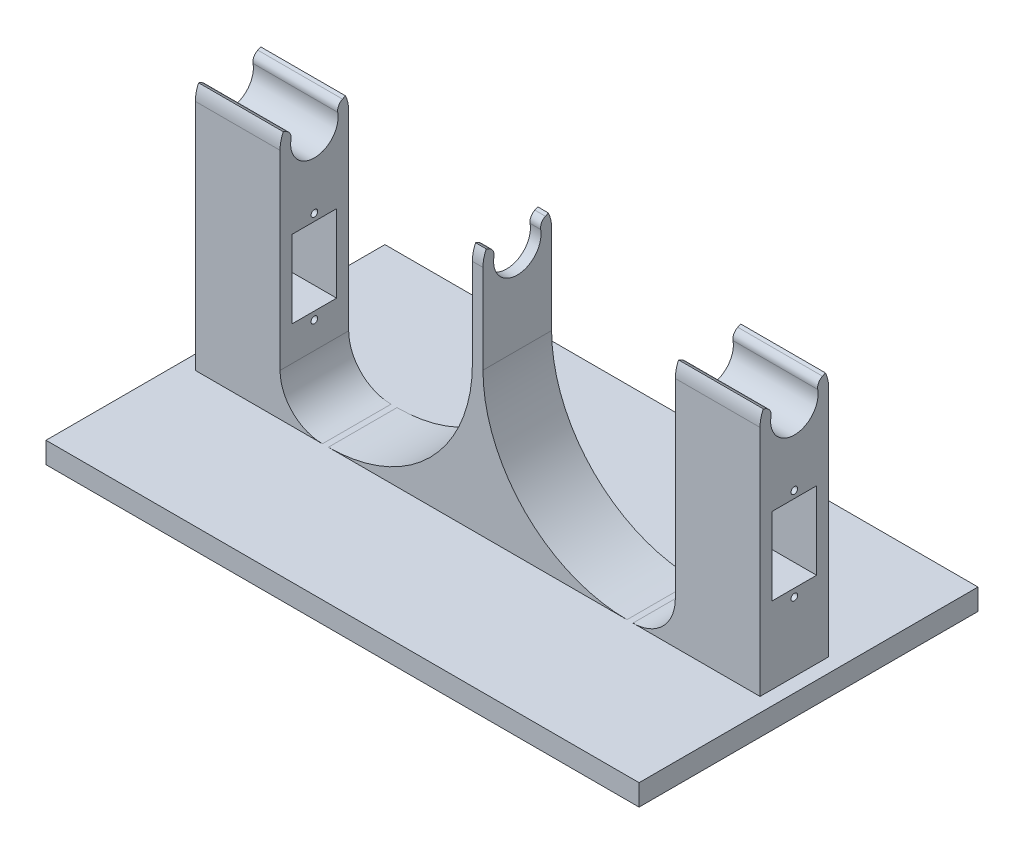
from build123d import *

# Parameters (mm, degrees)
SKETCH1_W           = 177.8
SKETCH1_H           = 101.6
BOSS_EXTRUDE1_DEPTH = 6.35
BOSS_EXTRUDE2_DEPTH = 177.8
SKETCH3_W           = 57.658
SKETCH3_H           = 101.6
SKETCH3_W_2         = 4.2545
CUT_EXTRUDE1_DEPTH  = 127.448072965
FILLET1_R           = 43.18
FILLET2_R           = 12.7
SKETCH5_R           = 1
SKETCH5_W           = 13.335
SKETCH5_H           = 23.241
CUT_EXTRUDE2_DEPTH  = 177.112534328
CUT_EXTRUDE3_START  = 118.491
SKETCH5_2_R         = 1
SKETCH5_2_W         = 13.335
SKETCH5_2_H         = 23.241
CUT_EXTRUDE3_DEPTH  = 58.621534328
FILLET4_R           = 2.54


with BuildPart() as part:
    # Sketch1 → Boss-Extrude1 (new body)
    with BuildSketch(Plane(origin=(0, 0, 0), x_dir=(1, 0, 0), z_dir=(0, 1, 0))):
        Rectangle(SKETCH1_W, SKETCH1_H)
    extrude(amount=BOSS_EXTRUDE1_DEPTH)

    # Sketch2 → Boss-Extrude2 (add)
    with BuildSketch(Plane.ZY.offset(88.9)):
        with BuildLine():
            Line((0, 69.088), (0, 6.35))
            Line((0, 6.35), (10.287, 6.35))
            Line((10.287, 6.35), (10.287, 76.2))
            ThreePointArc((10.287, 76.2), (10.043157025, 78.426514309), (9.323188205, 80.547474059))
            Line((9.323188205, 80.547474059), (6.445660981, 79.205661077))
            ThreePointArc((6.445660981, 79.205661077), (5.998199963, 72.378725185), (0, 69.088))
        make_face()
        with BuildLine():
            Line((-10.287, 76.2), (-10.287, 6.35))
            Line((-10.287, 6.35), (0, 6.35))
            Line((0, 6.35), (0, 69.088))
            ThreePointArc((0, 69.088), (-5.998199963, 72.378725185), (-6.445660981, 79.205661077))
            Line((-6.445660981, 79.205661077), (-9.323188205, 80.547474059))
            ThreePointArc((-9.323188205, 80.547474059), (-10.043157025, 78.426514309), (-10.287, 76.2))
        make_face()
    extrude(amount=-BOSS_EXTRUDE2_DEPTH)

    # Sketch3 → Cut-Extrude1 (cut, through all)
    with BuildSketch(Plane(origin=(0, 6.35, 0), x_dir=(1, 0, 0), z_dir=(0, 1, 0))):
        with Locations((-30.4165, 0)):
            Rectangle(SKETCH3_W, SKETCH3_H)
        with Locations((30.4165, 0)):
            Rectangle(SKETCH3_W, SKETCH3_H)
        with Locations((86.77275, 0)):
            Rectangle(SKETCH3_W_2, SKETCH3_H)
        with Locations((-86.77275, 0)):
            Rectangle(SKETCH3_W_2, SKETCH3_H)
    extrude(amount=CUT_EXTRUDE1_DEPTH, mode=Mode.SUBTRACT)

    # Fillet1
    fillet1_edges = [part.edges().sort_by_distance(p)[0] for p in [
        (1.5875, 6.35, 0),
        (-1.5875, 6.35, 0),
    ]]
    fillet(fillet1_edges, radius=FILLET1_R)

    # Fillet2
    fillet2_edges = [part.edges().sort_by_distance(p)[0] for p in [
        (59.2455, 6.35, 0),
        (-59.2455, 6.35, 0),
    ]]
    fillet(fillet2_edges, radius=FILLET2_R)

    # Sketch5 → Cut-Extrude2 (cut, through all)
    with BuildSketch(Plane.ZY.offset(-59.2455)):
        with Locations((0, 54.7)):
            Circle(SKETCH5_R)
        with Locations((0, 27.014)):
            Circle(SKETCH5_R)
        with Locations((0, 40.9615)):
            Rectangle(SKETCH5_W, SKETCH5_H)
    extrude(amount=-CUT_EXTRUDE2_DEPTH, mode=Mode.SUBTRACT)

    # Sketch5<2> → Cut-Extrude3 (cut, through all)
    with BuildSketch(Plane.ZY.offset(-59.2455).offset(CUT_EXTRUDE3_START)):
        with Locations((0, 54.7)):
            Circle(SKETCH5_2_R)
        with Locations((0, 27.014)):
            Circle(SKETCH5_2_R)
        with Locations((0, 40.9615)):
            Rectangle(SKETCH5_2_W, SKETCH5_2_H)
    extrude(amount=CUT_EXTRUDE3_DEPTH, mode=Mode.SUBTRACT)

    # Fillet4
    fillet4_edges = [part.edges().sort_by_distance(p)[0] for p in [
        (71.9455, 79.205661077, -6.445660981),
        (0, 79.205661077, -6.445660981),
        (-71.9455, 79.205661077, -6.445660981),
        (71.9455, 79.205661077, 6.445660981),
        (0, 79.205661077, 6.445660981),
        (-71.9455, 79.205661077, 6.445660981),
    ]]
    fillet(fillet4_edges, radius=FILLET4_R)


solid = part.part
